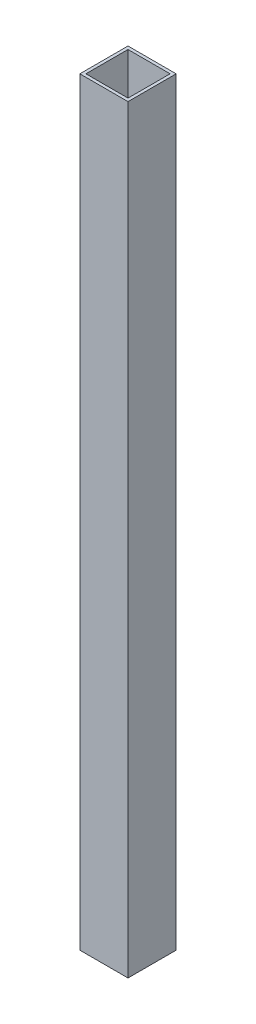
from build123d import *

# Parameters (mm, degrees)
SKETCH1_W           = 50.8
SKETCH1_H           = 50.8
SKETCH1_W_2         = 44.45
SKETCH1_H_2         = 44.45
BOSS_EXTRUDE1_DEPTH = 800.8112


with BuildPart() as part:
    # Sketch1 → Boss-Extrude1 (new body)
    with BuildSketch(Plane(origin=(0, 0, 0), x_dir=(1, 0, 0), z_dir=(0, 1, 0))):
        Rectangle(SKETCH1_W, SKETCH1_H)
        Rectangle(SKETCH1_W_2, SKETCH1_H_2, mode=Mode.SUBTRACT)
    extrude(amount=BOSS_EXTRUDE1_DEPTH)


solid = part.part
